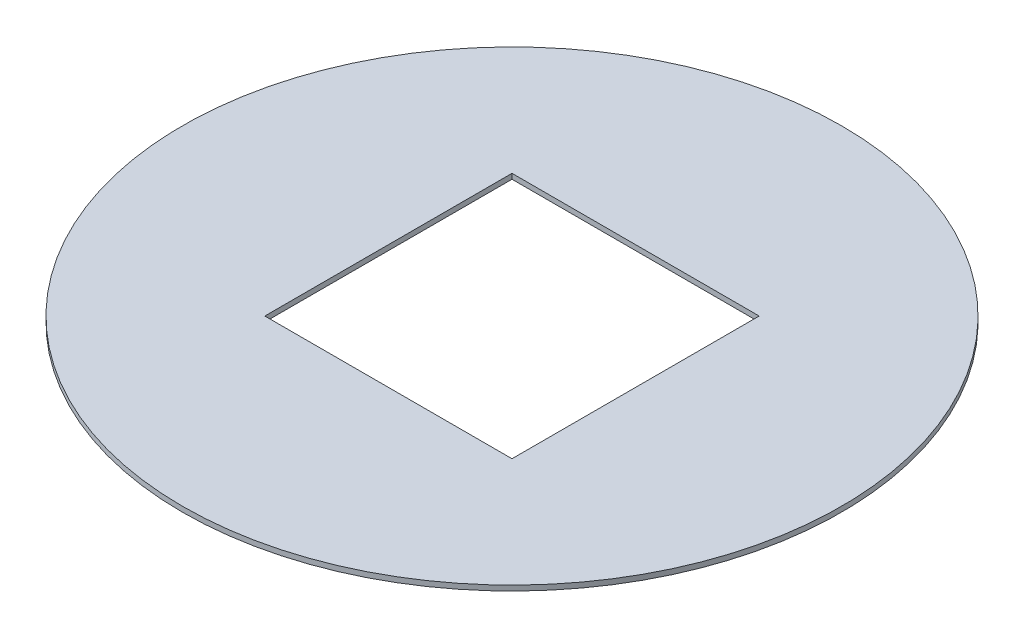
from build123d import *

# Parameters (mm, degrees)
SKETCH1_W           = 40
SKETCH1_H           = 1.57
BOSS_EXTRUDE1_START = -1.57
SKETCH2_R           = 60
SKETCH2_W           = 75
SKETCH2_H           = 75
BOSS_EXTRUDE1_DEPTH = 1.57


with BuildPart() as part:
    # Sketch1 → Revolve1 (revolve)
    with BuildSketch(Plane.XY, mode=Mode.PRIVATE) as revolve1_sk:
        with Locations((-80, 0)):
            Rectangle(SKETCH1_W, SKETCH1_H)
    revolve(revolve1_sk.sketch.rotate(Axis((0, -200069.047495165, 0), (0, 1, 0)), 270), axis=Axis((0, -200069.047495165, 0), (0, 1, 0)))

    # Sketch2 → Boss-Extrude1 (add)
    with BuildSketch(Plane(origin=(0, 0.785, 0), x_dir=(1, 0, 0), z_dir=(0, 1, 0)).offset(BOSS_EXTRUDE1_START)):
        Circle(SKETCH2_R)
        Rectangle(SKETCH2_W, SKETCH2_H, mode=Mode.SUBTRACT)
    extrude(amount=BOSS_EXTRUDE1_DEPTH)


solid = part.part
